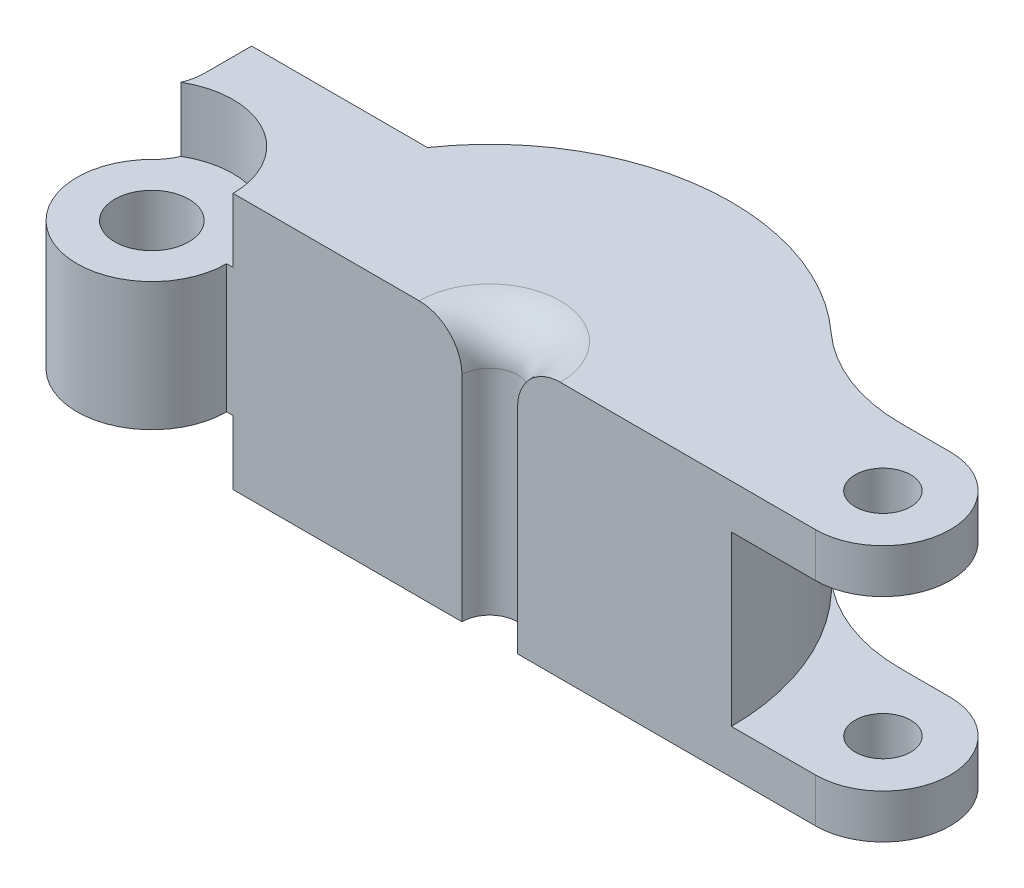
from build123d import *

# Parameters (mm, degrees)
SKETCH1_R               = 2.200000000000002
SKETCH1_R_2             = 1.6499999999999986
BOSS_EXTRUDE1_DEPTH     = 15.239999999999998
SKETCH2_R               = 4.8260000000000005
CUT_EXTRUDE1_DEPTH      = 3.8099999999999996
FILLET2_R               = 2.54
FILLET3_R               = 3
CUT_EXTRUDE2_DEPTH      = 5
CUT_EXTRUDE2_DEPTH_BACK = 5
FILLET4_R               = 10


with BuildPart() as part:
    # Sketch1 → Boss-Extrude1 (new body)
    with BuildSketch(Plane(origin=(0, 0, 0), x_dir=(1, 0, 0), z_dir=(0, 1, 0))):
        with BuildLine():
            ThreePointArc((11.827375744432914, 8.128), (0, 14.350999999999997), (-11.827375744432915, 8.128))
            Line((-11.827375744432912, 8.128), (-22.270000000000003, 8.127999999999998))
            Line((-22.270000000000003, 8.127999999999998), (-22.270000000000003, 3.8623859206454227))
            ThreePointArc((-22.270000000000003, 3.8623859206454245), (-22.30372167021767, -3.8429822403961222), (-15.625000000000004, -6.7e-16))
            Line((-15.625, 0), (-1.6509999999999998, 0))
            ThreePointArc((-1.651, -4.2e-16), (-3.8e-16, 1.6509999999999998), (1.6509999999999996, 0))
            Line((1.6509999999999998, 0), (14.350999999999999, -1.6e-16))
            Line((14.350999999999999, -1.6e-16), (19.351, 8.7e-16))
            ThreePointArc((19.351, 1.78e-15), (23.351, 4.000000000000002), (19.351, 8.000000000000002))
            Line((19.351, 8.000000000000002), (11.914327551314004, 8))
            ThreePointArc((11.914327551314003, 7.999999999999999), (11.871024170046155, 8.064117196208148), (11.82737574443291, 8.128))
        make_face()
        with Locations(Location((-20.07, 0, 0), (0, 0, 90))):
            Circle(SKETCH1_R, mode=Mode.SUBTRACT)
        with Locations(Location((19.351, 4.000000000000001, 0), (0, 0, 90))):
            Circle(SKETCH1_R_2, mode=Mode.SUBTRACT)
    extrude(amount=BOSS_EXTRUDE1_DEPTH)

    # Sketch2 → Cut-Extrude1 (cut, symmetric)
    with BuildSketch(Plane(origin=(0, 15.239999999999998, 0), x_dir=(1, 0, 0), z_dir=(0, 1, 0))):
        with Locations((-20.07, 0)):
            Circle(SKETCH2_R)
    cut_extrude1 = extrude(amount=CUT_EXTRUDE1_DEPTH, both=True, mode=Mode.SUBTRACT)

    # Fillet2
    fillet2_edges = [part.edges().sort_by_distance(p)[0] for p in [
        (-3.8e-16, 15.239999999999998, -1.6509999999999998),
    ]]
    fillet(fillet2_edges, radius=FILLET2_R)

    # Mirror1: Cut-Extrude1 across plane
    add(cut_extrude1.mirror(Plane.ZX.offset(7.619999999999999)), mode=Mode.SUBTRACT)

    # Fillet3
    fillet3_edges = [part.edges().sort_by_distance(p)[0] for p in [
        (-22.270000000000003, 7.619999999999999, -3.8623859206454227),
    ]]
    fillet(fillet3_edges, radius=FILLET3_R)

    # Sketch3 → Cut-Extrude2 (cut, two sides: drawn at the far end of the back side and taken through both)
    with BuildSketch(Plane(origin=(0, 7.619999999999999, 0), x_dir=(1, 0, 0), z_dir=(0, 1, 0)).offset(-CUT_EXTRUDE2_DEPTH_BACK)):
        with BuildLine():
            Line((14.350999999999999, -1.6e-16), (19.351, 8.7e-16))
            ThreePointArc((19.351, 8.7e-16), (23.351, 4.000000000000001), (19.351, 8))
            Line((19.351, 8), (11.914327551314004, 8))
            ThreePointArc((11.914327551314004, 8), (13.728323198572127, 4.181428363077186), (14.350999999999999, -1.6e-16))
        make_face()
    extrude(amount=CUT_EXTRUDE2_DEPTH + CUT_EXTRUDE2_DEPTH_BACK, mode=Mode.SUBTRACT)

    # Fillet4
    fillet4_edges = [part.edges().sort_by_distance(p)[0] for p in [
        (11.914327551314003, 13.93, -8),
        (11.914327551314003, 1.3099999999999996, -8),
    ]]
    fillet(fillet4_edges, radius=FILLET4_R)


solid = part.part
